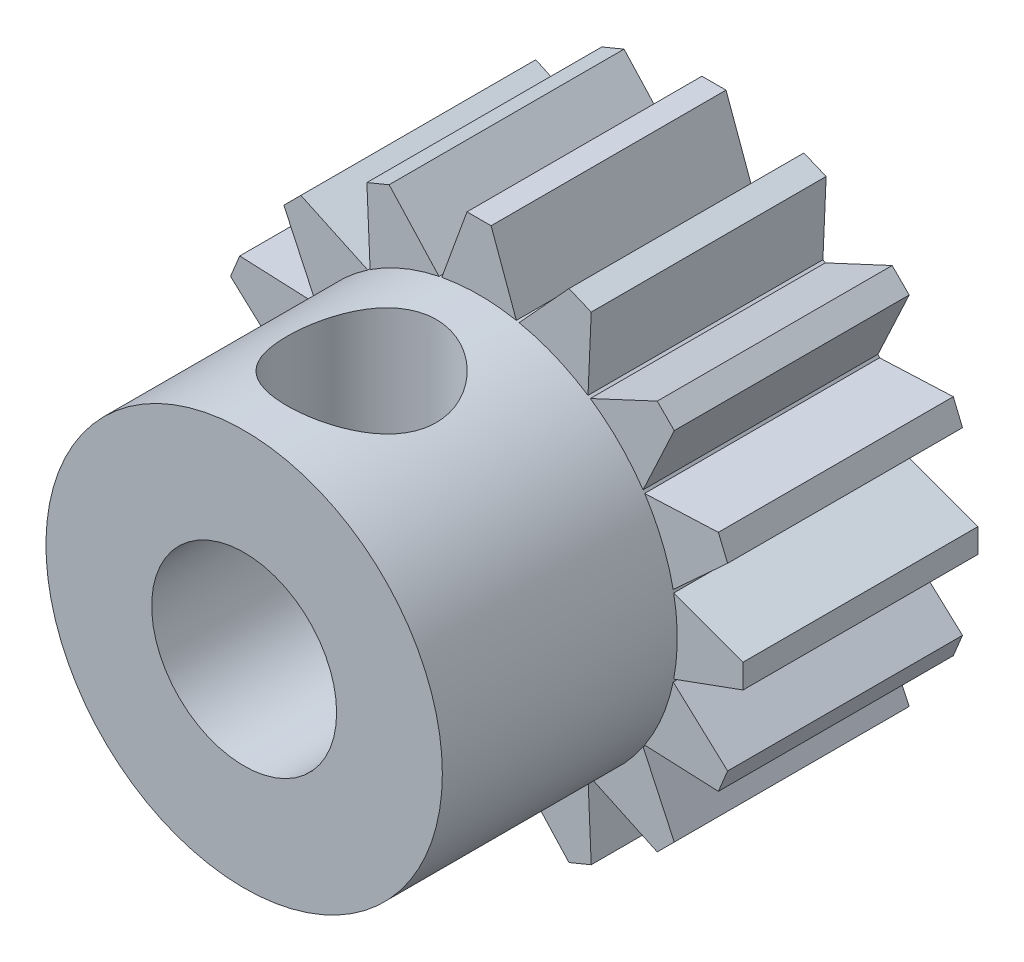
from build123d import *

# Parameters (mm, degrees)
BOSS_EXTRUDE1_DEPTH    = 6.35
SKETCH2_R              = 5.357812451
BOSS_EXTRUDE2_DEPTH    = 6.35
F_10_CLEARANCE_HOLE1_D = 5
SKETCH5_W              = 2.0193
SKETCH5_H              = 5.66348411


with BuildPart() as part:
    # Sketch1 → Boss-Extrude1 (new body)
    with BuildSketch(Plane(origin=(0, 0, -3.175), x_dir=(-1, 0, 0), z_dir=(0, 0, -1))):
        with BuildLine():
            Line((-4.475719216, 2.94518093), (-6.469475121, 3.032230191))
            Line((-6.469475121, 3.032230191), (-6.718720366, 2.430498941))
            Line((-6.718720366, 2.430498941), (-5.247368905, 1.082253729))
            ThreePointArc((-5.247368905, 1.082253729), (-5.25486353, 1.045257315), (-5.262097316, 1.008209016))
            Line((-5.262097316, 1.008209016), (-7.137399981, 0.325654666))
            Line((-7.137399981, 0.325654666), (-7.137399981, -0.325654551))
            Line((-7.137399981, -0.325654551), (-5.262097381, -1.008208899))
            ThreePointArc((-5.262097381, -1.008208899), (-5.254863555, -1.045257412), (-5.247368888, -1.08225404))
            Line((-5.247368888, -1.08225404), (-6.718720366, -2.43049927))
            Line((-6.718720366, -2.43049927), (-6.469475121, -3.03223052))
            Line((-6.469475121, -3.03223052), (-4.475719151, -2.945181254))
            ThreePointArc((-4.475719151, -2.945181254), (-4.454858201, -2.97664122), (-4.433776122, -3.007953433))
            Line((-4.433776122, -3.007953433), (-5.277176571, -4.816631533))
            Line((-5.277176571, -4.816631533), (-4.816631353, -5.277176632))
            Line((-4.816631353, -5.277176632), (-3.007953331, -4.433776241))
            ThreePointArc((-3.007953331, -4.433776241), (-2.976641072, -4.454858352), (-2.945181059, -4.475719332))
            Line((-2.945181059, -4.475719332), (-3.032230324, -6.469475317))
            Line((-3.032230324, -6.469475317), (-2.430499074, -6.718720562))
            Line((-2.430499074, -6.718720562), (-1.082253821, -5.247369057))
            ThreePointArc((-1.082253821, -5.247369057), (-1.045257355, -5.254863691), (-1.008209005, -5.262097487))
            Line((-1.008209005, -5.262097487), (-0.325654634, -7.137400208))
            Line((-0.325654634, -7.137400208), (0.325654583, -7.137400208))
            Line((0.325654583, -7.137400208), (1.008208941, -5.262097516))
            ThreePointArc((1.008208941, -5.262097516), (1.045257356, -5.254863709), (1.082253886, -5.247369061))
            Line((1.082253886, -5.247369061), (2.430499137, -6.718720562))
            Line((2.430499137, -6.718720562), (3.032230387, -6.469475317))
            Line((3.032230387, -6.469475317), (2.945181121, -4.475719349))
            ThreePointArc((2.945181121, -4.475719349), (2.976641089, -4.454858399), (3.007953303, -4.433776319))
            Line((3.007953303, -4.433776319), (4.8166314, -5.277176767))
            Line((4.8166314, -5.277176767), (5.277176499, -4.816631549))
            Line((5.277176499, -4.816631549), (4.433776123, -3.007953559))
            ThreePointArc((4.433776123, -3.007953559), (4.454858245, -2.976641285), (4.475719236, -2.945181257))
            Line((4.475719236, -2.945181257), (6.469475184, -3.03223052))
            Line((6.469475184, -3.03223052), (6.718720429, -2.43049927))
            Line((6.718720429, -2.43049927), (5.247368971, -1.08225406))
            ThreePointArc((5.247368971, -1.08225406), (5.254863613, -1.045257562), (5.262097415, -1.008209179))
            Line((5.262097415, -1.008209179), (7.137400075, -0.32565483))
            Line((7.137400075, -0.32565483), (7.137400075, 0.325654387))
            Line((7.137400075, 0.325654387), (5.26209746, 1.008208717))
            ThreePointArc((5.26209746, 1.008208717), (5.254863645, 1.045257174), (5.247368989, 1.082253746))
            Line((5.247368989, 1.082253746), (6.718720429, 2.430498941))
            Line((6.718720429, 2.430498941), (6.469475184, 3.032230191))
            Line((6.469475184, 3.032230191), (4.475719304, 2.945180929))
            ThreePointArc((4.475719304, 2.945180929), (4.454858329, 2.976640935), (4.433776224, 3.007953186))
            Line((4.433776224, 3.007953186), (5.277176634, 4.816631204))
            Line((5.277176634, 4.816631204), (4.816631416, 5.277176303))
            Line((4.816631416, 5.277176303), (3.007953499, 4.433775961))
            ThreePointArc((3.007953499, 4.433775961), (2.976641191, 4.454858106), (2.945181127, 4.47571912))
            Line((2.945181127, 4.47571912), (3.032230387, 6.469474988))
            Line((3.032230387, 6.469474988), (2.430499137, 6.718720233))
            Line((2.430499137, 6.718720233), (1.082253963, 5.24736882))
            ThreePointArc((1.082253963, 5.24736882), (1.045257437, 5.254863468), (1.008209026, 5.262097275))
            Line((1.008209026, 5.262097275), (0.325654697, 7.137399816))
            Line((0.325654697, 7.137399816), (-0.32565452, 7.137399816))
            Line((-0.32565452, 7.137399816), (-1.008208848, 5.262097292))
            ThreePointArc((-1.008208848, 5.262097292), (-1.045257316, 5.254863474), (-1.082253899, 5.247368816))
            Line((-1.082253899, 5.247368816), (-2.430499074, 6.718720233))
            Line((-2.430499074, 6.718720233), (-3.032230324, 6.469474988))
            Line((-3.032230324, 6.469474988), (-2.945181062, 4.475719106))
            ThreePointArc((-2.945181062, 4.475719106), (-2.976641066, 4.454858131), (-3.007953316, 4.433776026))
            Line((-3.007953316, 4.433776026), (-4.816631337, 5.277176438))
            Line((-4.816631337, 5.277176438), (-5.277176436, 4.81663122))
            Line((-5.277176436, 4.81663122), (-4.433776079, 3.007953271))
            ThreePointArc((-4.433776079, 3.007953271), (-4.454858213, 2.976640978), (-4.475719216, 2.94518093))
        make_face()
    extrude(amount=-BOSS_EXTRUDE1_DEPTH)

    # Sketch2 → Boss-Extrude2 (add)
    with BuildSketch(Plane.XY.offset(3.175)):
        with Locations(Location((-1.2e-08, 5.2e-08, 0), (0, 0, 169.153676475))):
            Circle(SKETCH2_R)
    extrude(amount=BOSS_EXTRUDE2_DEPTH)

    # #10 Clearance Hole1 (through all)
    with Locations(Plane.XY.offset(9.525)):
        with Locations((0, 0)):
            Hole(F_10_CLEARANCE_HOLE1_D / 2)

    # Sketch5 → #21 (0.159) Diameter Hole1 (revolve, cut)
    with BuildSketch(Plane(origin=(0, 1.473915707, 6.35), x_dir=(0, 0, -1), z_dir=(1, 0, 0))):
        with Locations((1.00965, 2.831742055)):
            Rectangle(SKETCH5_W, SKETCH5_H)
    revolve(axis=Axis((0, -4.876084293, 6.35), (0, 1, 0)), mode=Mode.SUBTRACT)


solid = part.part
